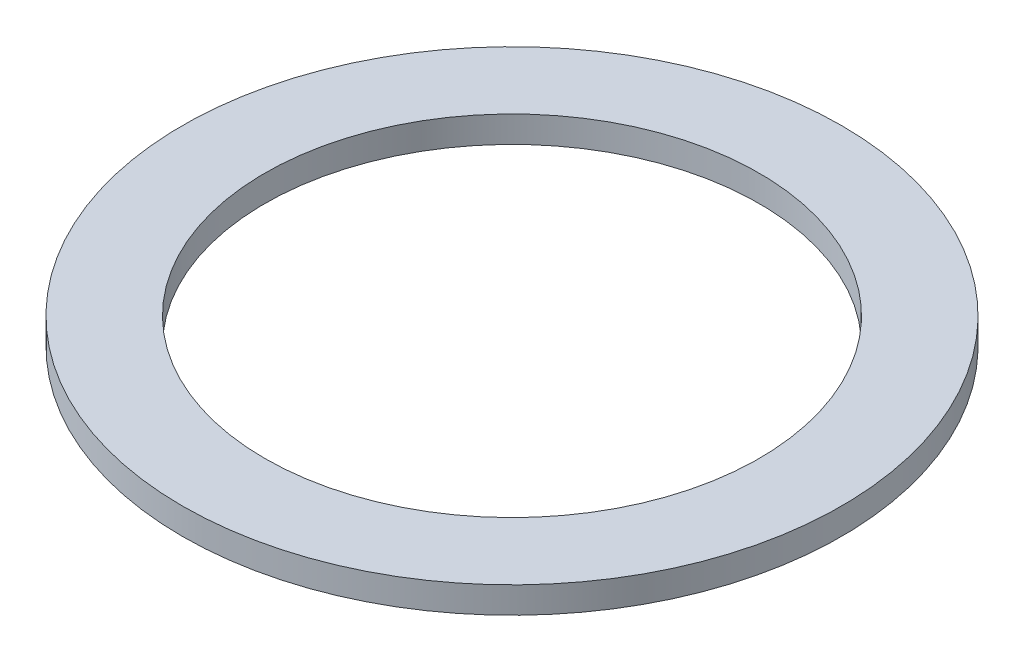
from build123d import *

# Parameters (mm, degrees)
SKETCH1_R           = 50
SKETCH1_R_2         = 37.5
BOSS_EXTRUDE1_DEPTH = 4


with BuildPart() as part:
    # Sketch1 → Boss-Extrude1 (new body)
    with BuildSketch(Plane(origin=(0, 0, 0), x_dir=(1, 0, 0), z_dir=(0, 1, 0))):
        with Locations(Location((0, 0, 0), (0, 0, 270))):
            Circle(SKETCH1_R)
        with Locations(Location((0, 0, 0), (0, 0, 270))):
            Circle(SKETCH1_R_2, mode=Mode.SUBTRACT)
    extrude(amount=BOSS_EXTRUDE1_DEPTH)


solid = part.part
